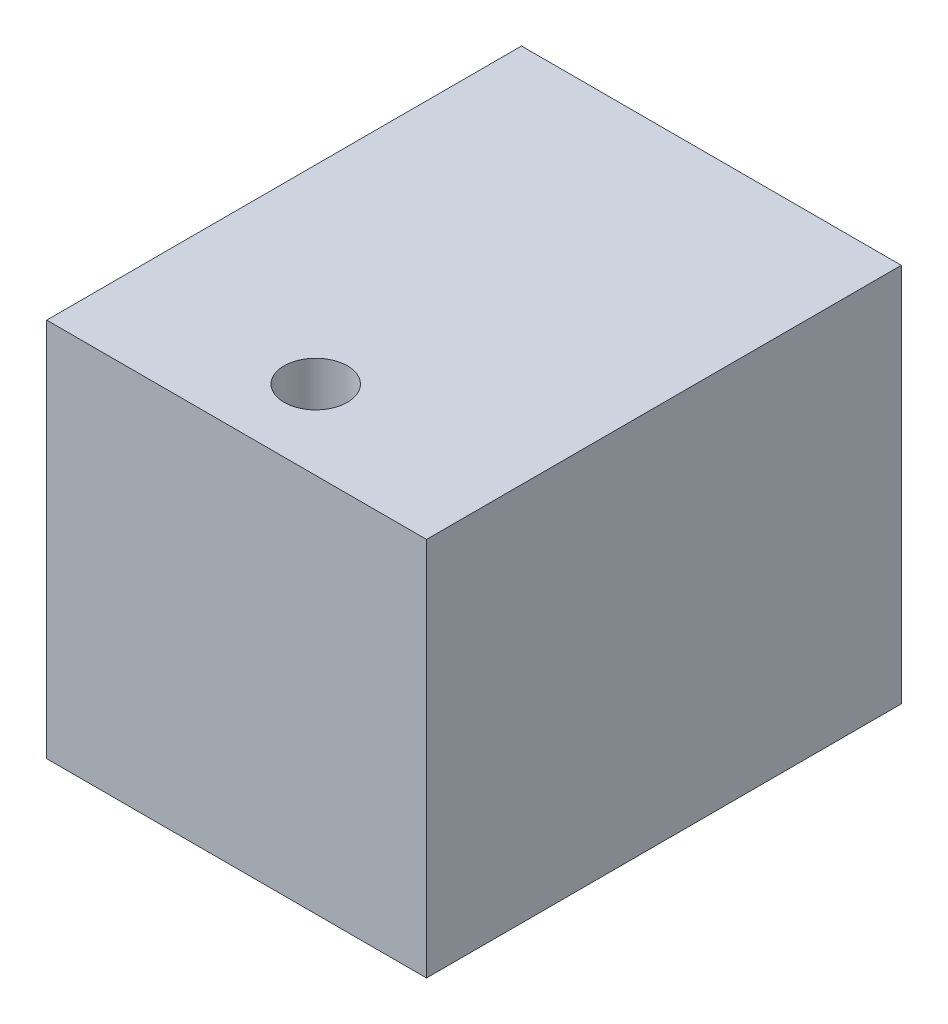
from build123d import *

# Parameters (mm, degrees)
SKETCH_1_W          = 12
SKETCH_1_H          = 12
SKETCH_1_W_2        = 10
SKETCH_1_H_2        = 10
EXTRUDE_1_DEPTH     = 10
SKETCH_2_W          = 12
SKETCH_2_H          = 12
EXTRUDE_2_DEPTH     = 5
SKETCH_3_R          = 1
CUT_EXTRUDE_3_DEPTH = 12


with BuildPart() as part:
    # 草图1 → 凸台-拉伸1 (new body)
    with BuildSketch(Plane.XY):
        with Locations((6, 6)):
            Rectangle(SKETCH_1_W, SKETCH_1_H)
        with Locations((6, 6)):
            Rectangle(SKETCH_1_W_2, SKETCH_1_H_2, mode=Mode.SUBTRACT)
    extrude(amount=EXTRUDE_1_DEPTH)

    # 草图2 → 凸台-拉伸2 (add)
    with BuildSketch(Plane.XY.offset(10)):
        with Locations((6, 6)):
            Rectangle(SKETCH_2_W, SKETCH_2_H)
    extrude(amount=EXTRUDE_2_DEPTH)

    # 草图3 → 切除-拉伸3 (cut)
    with BuildSketch(Plane(origin=(0, 0, 0), x_dir=(-1, 0, 0), z_dir=(0, -1, 0))):
        with Locations(Location((-6, -12.5, 0), (0, 0, 90))):
            Circle(SKETCH_3_R)
    extrude(amount=-CUT_EXTRUDE_3_DEPTH, mode=Mode.SUBTRACT)


solid = part.part
